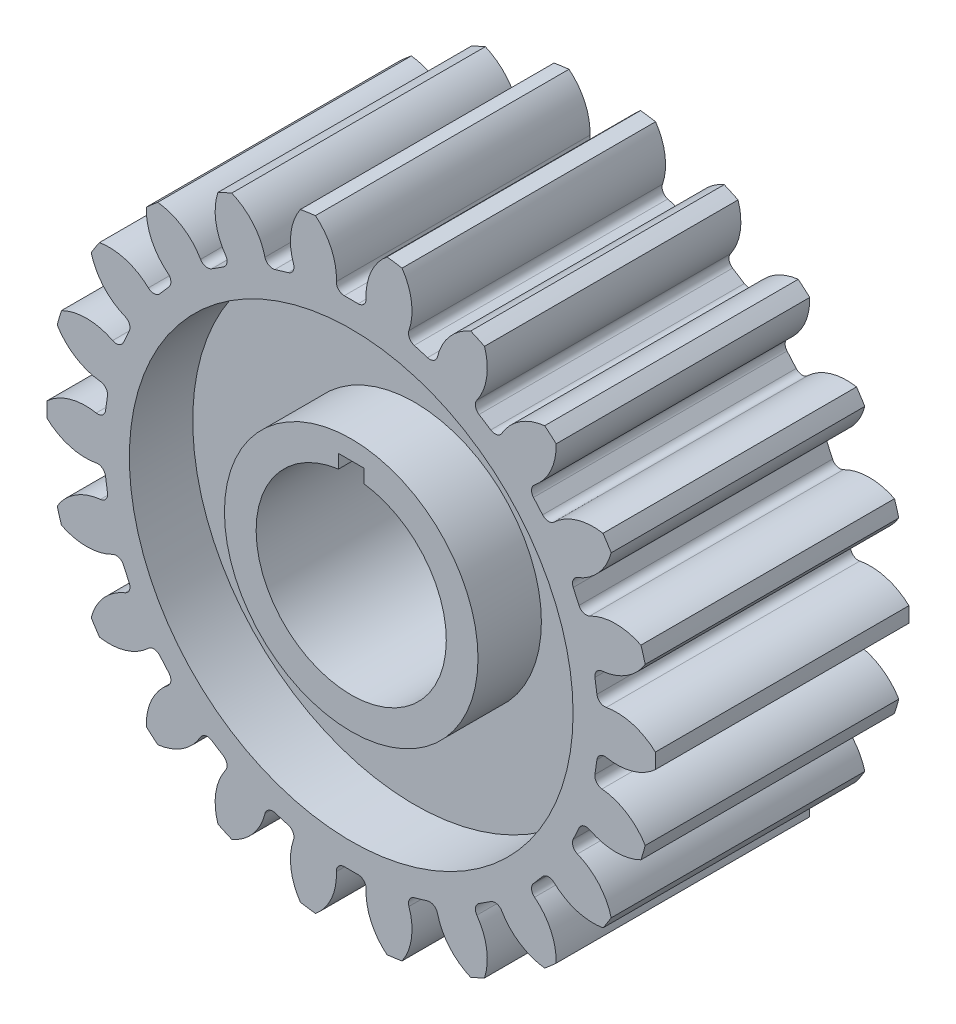
from build123d import *

# Parameters (mm, degrees)
SKETCH1_R                       = 24
GEAR_PROFILE_DEPTH              = 10
TEETH_PROFILE_DEPTH             = 40.395431207
TEETH_PROFILE_PATTERN_COUNT     = 22
GEAR_BORE_DEPTH                 = 40.294317266
SKETCH4_R                       = 17.5
SKETCH4_R_2                     = 10
WEIGHT_REDUCTION_POCKET_1_DEPTH = 5


with BuildPart() as part:
    # Sketch1 → Gear Profile (new, symmetric)
    with BuildSketch(Plane.XY):
        Circle(SKETCH1_R)
    extrude(amount=GEAR_PROFILE_DEPTH, both=True)

    # Sketch2 → Teeth profile (cut, through all)
    with BuildSketch(Plane.XY.offset(10)):
        with BuildLine():
            Line((-0.548964344, 19.5), (0.548964344, 19.5))
            ThreePointArc((0.548964344, 19.5), (1.000494556, 19.692859435), (1.173362811, 20.152414503))
            ThreePointArc((1.173362811, 20.152414503), (1.561563454, 22.187924068), (2.82075, 23.833660429))
            ThreePointArc((2.82075, 23.833660429), (0, 24), (-2.82075, 23.833660429))
            ThreePointArc((-2.82075, 23.833660429), (-1.561563454, 22.187924068), (-1.173362811, 20.152414503))
            ThreePointArc((-1.173362811, 20.152414503), (-1.000494556, 19.692859435), (-0.548964344, 19.5))
        make_face()
    teeth_profile = extrude(amount=-TEETH_PROFILE_DEPTH, mode=Mode.SUBTRACT)

    # Teeth  Profile Pattern: Teeth profile ×22 about axis
    teeth_profile_pattern_axis = Axis((0, 0, 0), (0, 0, 1))
    for i in range(1, TEETH_PROFILE_PATTERN_COUNT):
        add(teeth_profile.rotate(teeth_profile_pattern_axis, i * 360 / TEETH_PROFILE_PATTERN_COUNT), mode=Mode.SUBTRACT)

    # Sketch3 → Gear Bore (cut, through all)
    with BuildSketch(Plane.XY.offset(10)):
        with BuildLine():
            Line((-1, 7.433034374), (-1, 8.5))
            Line((-1, 8.5), (1, 8.5))
            Line((1, 8.5), (1, 7.433034374))
            ThreePointArc((1, 7.433034374), (0, -7.5), (-1, 7.433034374))
        make_face()
    extrude(amount=-GEAR_BORE_DEPTH, mode=Mode.SUBTRACT)

    # Sketch4 → Weight reduction Pocket 1 (cut)
    with BuildSketch(Plane.XY.offset(10)):
        Circle(SKETCH4_R)
        Circle(SKETCH4_R_2, mode=Mode.SUBTRACT)
    weight_reduction_pocket_1 = extrude(amount=-WEIGHT_REDUCTION_POCKET_1_DEPTH, mode=Mode.SUBTRACT)

    # Weight reduction Pocket 2: Weight reduction Pocket 1 across plane
    add(weight_reduction_pocket_1.mirror(Plane.XY), mode=Mode.SUBTRACT)


solid = part.part
